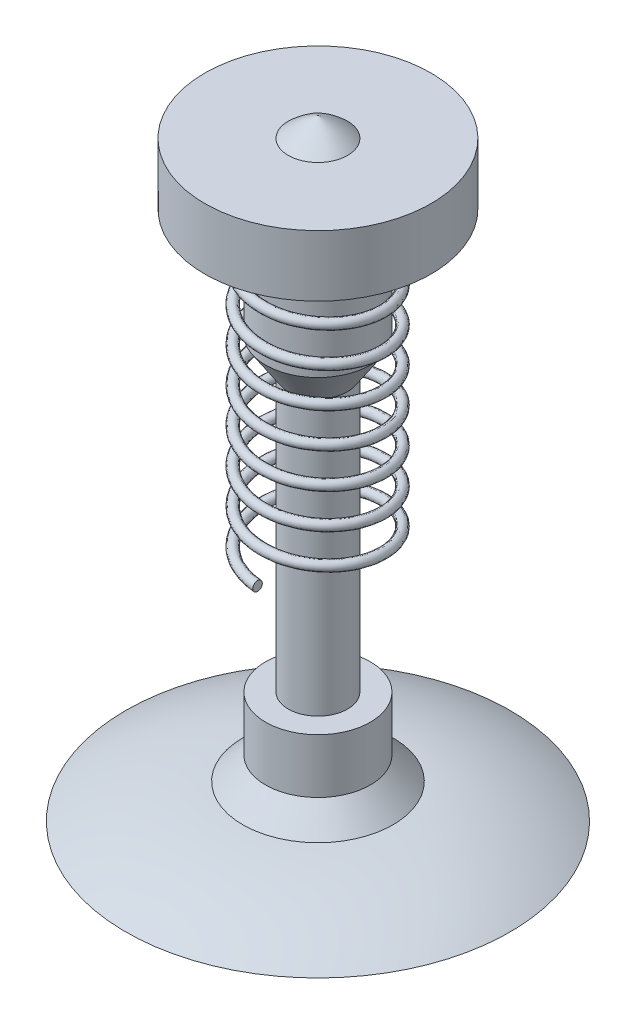
from build123d import *

# Parameters (mm, degrees)
SWEEP1_PITCH  = 5.08
SWEEP1_HEIGHT = 43.18
SWEEP1_RADIUS = 8.7376
SKETCH3_R     = 0.6985


with BuildPart() as part:
    # Sketch1 → Revolve1 (revolve)
    with BuildSketch(Plane.XY, mode=Mode.PRIVATE) as revolve1_sk:
        with BuildLine():
            Line((0.0508, 88.9), (0.0508, 0))
            Line((0.0508, 0), (27.9908, 0))
            ThreePointArc((27.9908, 0), (19.782928412, 3.496195529), (10.993008114, 5.022576976))
            Line((10.993008114, 5.022576976), (7.6708, 8.369250135))
            Line((7.6708, 8.369250135), (7.6708, 16.283977134))
            Line((7.6708, 16.283977134), (4.3688, 16.283977134))
            Line((4.3688, 16.283977134), (4.3688, 56.278414989))
            Line((4.3688, 56.278414989), (7.6708, 61.279385564))
            Line((7.6708, 61.279385564), (7.6708, 77.154385564))
            Line((7.6708, 77.154385564), (16.508776114, 77.154385564))
            Line((16.508776114, 77.154385564), (16.508776114, 86.044385564))
            Line((16.508776114, 86.044385564), (4.3688, 86.044385564))
            ThreePointArc((4.3688, 86.044385564), (2.310673225, 87.624724084), (0.0508, 88.9))
        make_face()
    revolve(revolve1_sk.sketch.rotate(Axis((0.0508, 88.9, 0), (0, -1, 0)), 180), axis=Axis((0.0508, 88.9, 0), (0, -1, 0)))

    # Sweep1: sweep along a helix
    with BuildLine() as sweep1_path:
        Helix(SWEEP1_PITCH, SWEEP1_HEIGHT, SWEEP1_RADIUS, center=(0, 77.154385564, 0), direction=(0, -1, 0), lefthand=True)
    # Sketch3 → Sweep1 (sweep)
    with BuildSketch(Plane.XY):
        with Locations((-8.7376, 70.804385558)):
            Circle(SKETCH3_R)
    sweep(path=sweep1_path.line, is_frenet=True)


solid = part.part
